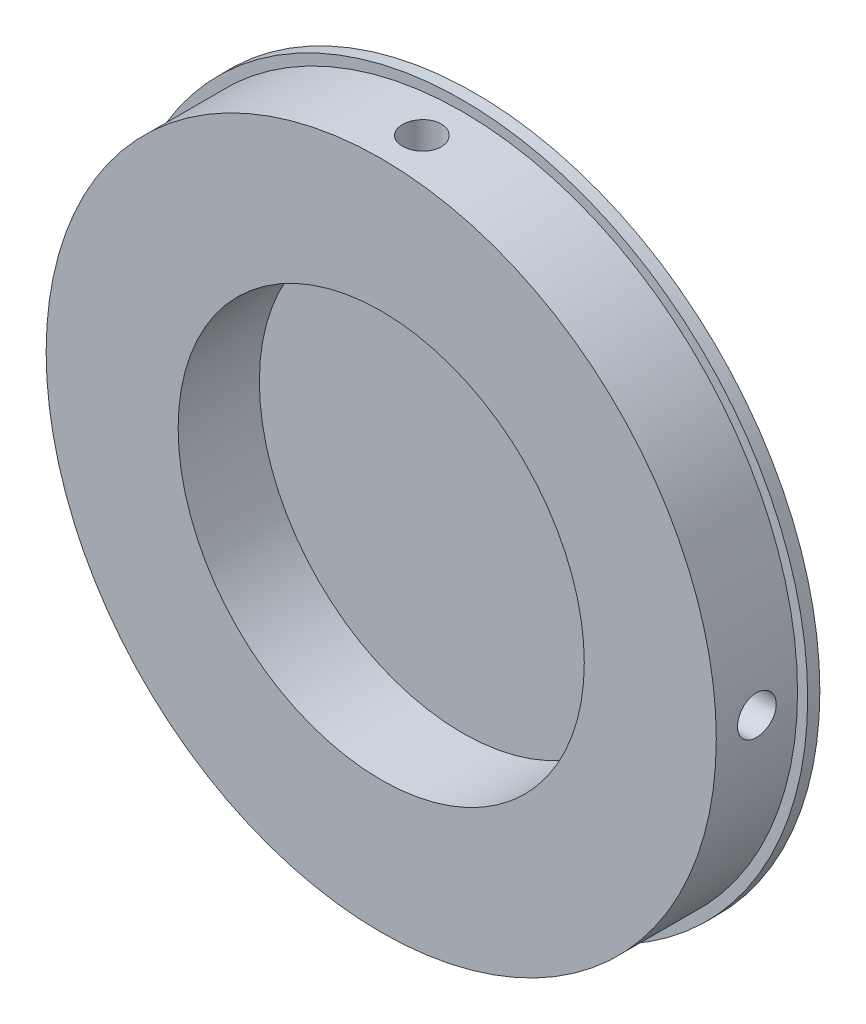
from build123d import *

# Parameters (mm, degrees)
SKETCH1_R           = 85
BOSS_EXTRUDE2_DEPTH = 3
SKETCH2_R           = 82.5
BOSS_EXTRUDE3_DEPTH = 20
SKETCH3_R           = 50
CUT_EXTRUDE1_DEPTH  = 20
SKETCH9_R           = 4.7625
CUT_EXTRUDE9_DEPTH  = 19.05
SKETCH14_R          = 4.7625
CUT_EXTRUDE10_DEPTH = 19.05
CUT_EXTRUDE11_START = 19.05
SKETCH13_R          = 4.7625
CUT_EXTRUDE11_DEPTH = 19.05
CUT_EXTRUDE12_START = 19.05
SKETCH15_R          = 4.7625
CUT_EXTRUDE12_DEPTH = 19.05


with BuildPart() as part:
    # Sketch1 → Boss-Extrude2 (new body)
    with BuildSketch(Plane.XY):
        Circle(SKETCH1_R)
    extrude(amount=BOSS_EXTRUDE2_DEPTH)

    # Sketch2 → Boss-Extrude3 (add)
    with BuildSketch(Plane.XY.offset(3)):
        Circle(SKETCH2_R)
    extrude(amount=BOSS_EXTRUDE3_DEPTH)

    # Sketch3 → Cut-Extrude1 (cut)
    with BuildSketch(Plane.XY.offset(23)):
        Circle(SKETCH3_R)
    extrude(amount=-CUT_EXTRUDE1_DEPTH, mode=Mode.SUBTRACT)

    # Sketch9 → Cut-Extrude9 (cut)
    with BuildSketch(Plane(origin=(0, 82.5, 0), x_dir=(-1, 0, 0), z_dir=(0, -1, 0))):
        with Locations((0, -13)):
            Circle(SKETCH9_R)
    extrude(amount=CUT_EXTRUDE9_DEPTH, mode=Mode.SUBTRACT)

    # Sketch14 → Cut-Extrude10 (cut)
    with BuildSketch(Plane(origin=(82.5, 0, 0), x_dir=(0, 0, -1), z_dir=(1, 0, 0))):
        with Locations((-13, 0)):
            Circle(SKETCH14_R)
    extrude(amount=-CUT_EXTRUDE10_DEPTH, mode=Mode.SUBTRACT)

    # Sketch13 → Cut-Extrude11 (cut)
    with BuildSketch(Plane(origin=(0, -82.5, 0), x_dir=(1, 0, 0), z_dir=(0, 1, 0)).offset(CUT_EXTRUDE11_START)):
        with Locations(Location((0, -13, 0), (0, 0, 180))):
            Circle(SKETCH13_R)
    extrude(amount=-CUT_EXTRUDE11_DEPTH, mode=Mode.SUBTRACT)

    # Sketch15 → Cut-Extrude12 (cut)
    with BuildSketch(Plane(origin=(-82.5, 0, 0), x_dir=(0, 0, -1), z_dir=(1, 0, 0)).offset(CUT_EXTRUDE12_START)):
        with Locations((-13, 0)):
            Circle(SKETCH15_R)
    extrude(amount=-CUT_EXTRUDE12_DEPTH, mode=Mode.SUBTRACT)


solid = part.part
